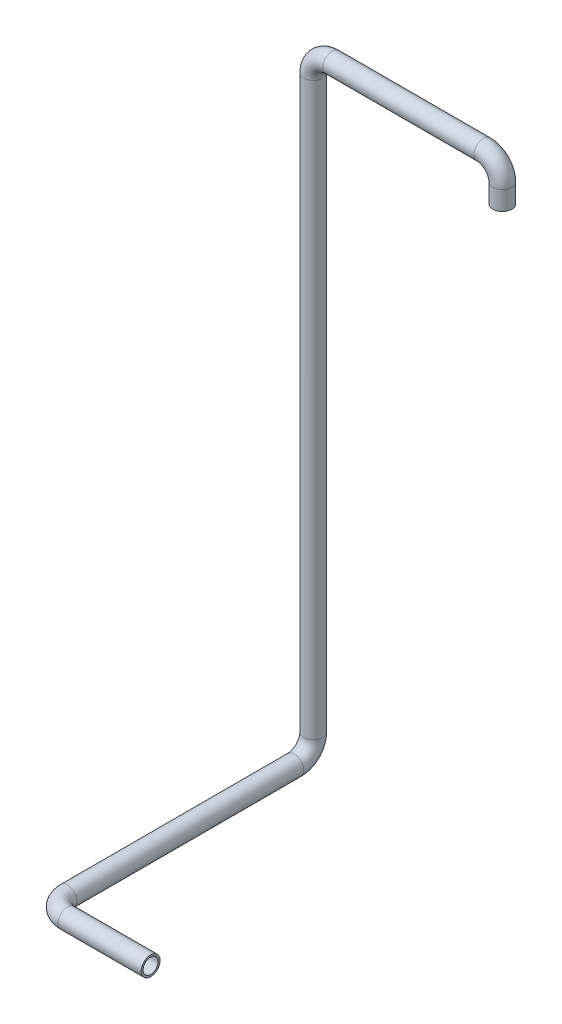
from build123d import *

# Parameters (mm, degrees)
SWEEP_1_PROFILE_R   = 5
SWEEP_1_PROFILE_R_2 = 4
SWEEP_2_PROFILE_R   = 5
SWEEP_2_PROFILE_R_2 = 4
SWEEP_3_PROFILE_R   = 5
SWEEP_3_PROFILE_R_2 = 4


with BuildPart() as part:
    # 扫描-薄件1: sweep along a path in 草图1
    with BuildLine(Plane.XY) as sweep_1_path:
        Line((0, 0), (0, 10))
        ThreePointArc((0, 10), (-2.928932188, 17.071067812), (-10, 20))
        Line((-10, 20), (-90, 20))
        ThreePointArc((-90, 20), (-97.071067812, 17.071067812), (-100, 10))
        Line((-100, 10), (-100, -290))
    # 扫描-薄件1 profile (on start of the path) → 扫描-薄件1 (sweep)
    with BuildSketch(Plane.ZX):
        Circle(SWEEP_1_PROFILE_R)
        Circle(SWEEP_1_PROFILE_R_2, mode=Mode.SUBTRACT)
    sweep(path=sweep_1_path.line)

    # 扫描-薄件2: sweep along a path in 草图2
    with BuildLine(Plane(origin=(-100, 0, 0), x_dir=(0, 0, -1), z_dir=(1, 0, 0))) as sweep_2_path:
        Line((0, -290), (0, -292))
        ThreePointArc((0, -292), (-2.928932188, -299.071067812), (-10, -302))
        Line((-10, -302), (-125, -302))
    # 扫描-薄件2 profile (on start of the path) → 扫描-薄件2 (sweep)
    with BuildSketch(Plane(origin=(-100, -290, 0), x_dir=(0, 0, -1), z_dir=(0, -1, 0))):
        Circle(SWEEP_2_PROFILE_R)
        Circle(SWEEP_2_PROFILE_R_2, mode=Mode.SUBTRACT)
    sweep(path=sweep_2_path.line)

    # 扫描-薄件3: sweep along a path in 草图10
    with BuildLine(Plane(origin=(0, -302, 0), x_dir=(1, 0, 0), z_dir=(0, 1, 0))) as sweep_3_path:
        Line((-100, -125), (-100, -130))
        ThreePointArc((-100, -130), (-97.071067812, -137.071067812), (-90, -140))
        Line((-90, -140), (-46, -140))
    # 扫描-薄件3 profile (on start of the path) → 扫描-薄件3 (sweep)
    with BuildSketch(Plane(origin=(-100, -302, 125), x_dir=(1, 0, 0), z_dir=(0, 0, 1))):
        Circle(SWEEP_3_PROFILE_R)
        Circle(SWEEP_3_PROFILE_R_2, mode=Mode.SUBTRACT)
    sweep(path=sweep_3_path.line)


solid = part.part
